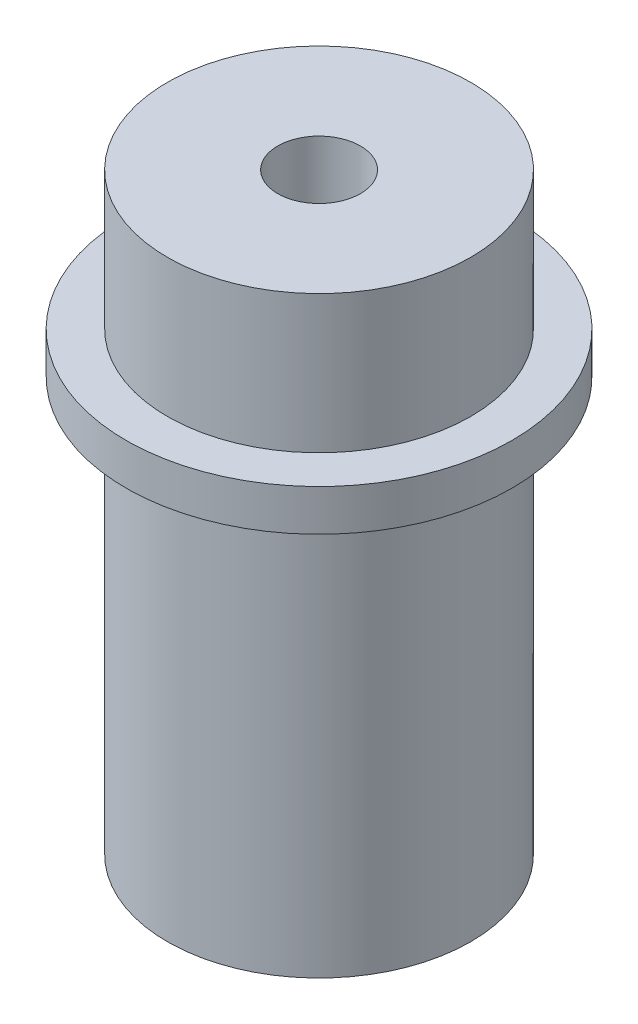
from build123d import *


with BuildPart() as part:
    # Sketch1 → Revolve1 (revolve)
    with BuildSketch(Plane.XY, mode=Mode.PRIVATE) as revolve1_sk:
        Polygon((-11, 0), (-3, 0), (-3, 43), (-11, 43), (-11, 33), (-14, 33), (-14, 30), (-11, 30), align=None)
    revolve(revolve1_sk.sketch.rotate(Axis((0, 0, 0), (0, 1, 0)), 180), axis=Axis((0, 0, 0), (0, 1, 0)))


solid = part.part
